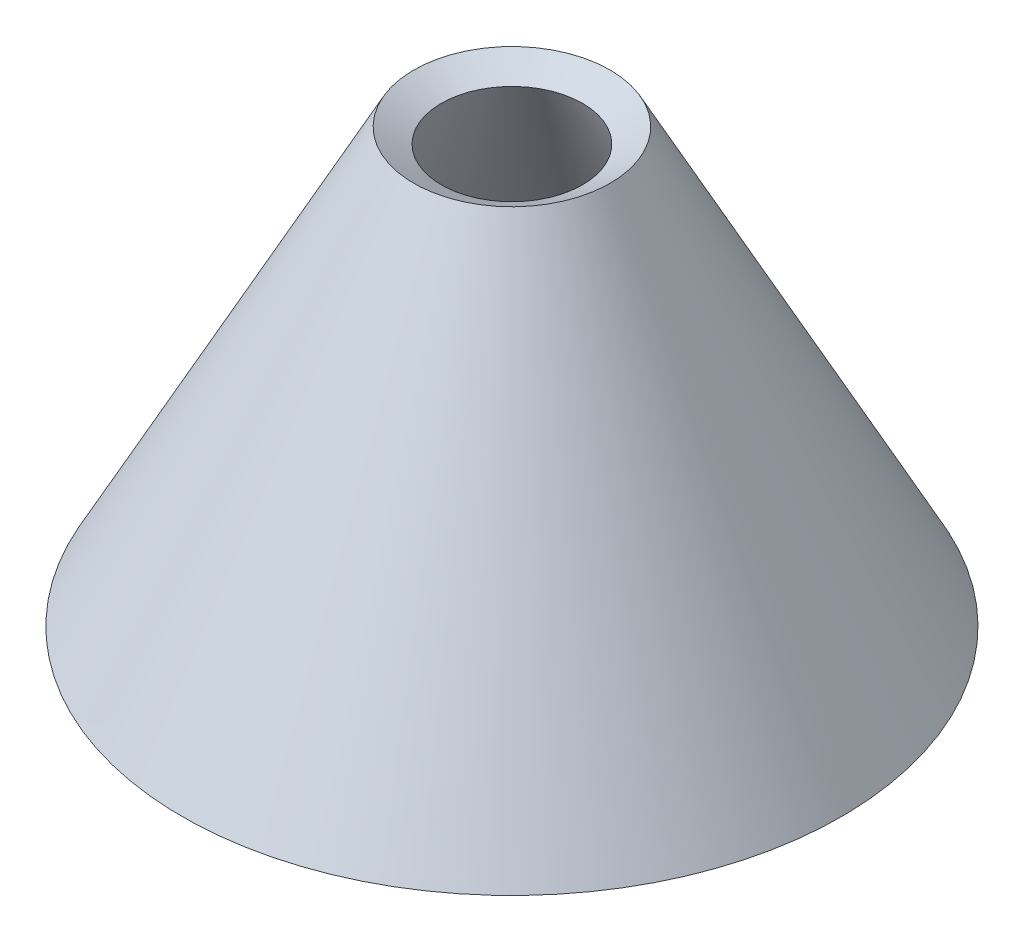
from build123d import *


with BuildPart() as part:
    # Esquisse1 → Révolution1 (revolve)
    with BuildSketch(Plane.XY, mode=Mode.PRIVATE) as r_volution1_sk:
        Polygon((-4.5, 13.563350189), (-19.231809643, -13.99059007), (-20.995449962, -13.047653662), (-6.253708042, 14.524863633), align=None)
    revolve(r_volution1_sk.sketch.rotate(Axis((0, 15.471761271, 0), (0, -1, 0)), 90), axis=Axis((0, 15.471761271, 0), (0, -1, 0)))


solid = part.part
